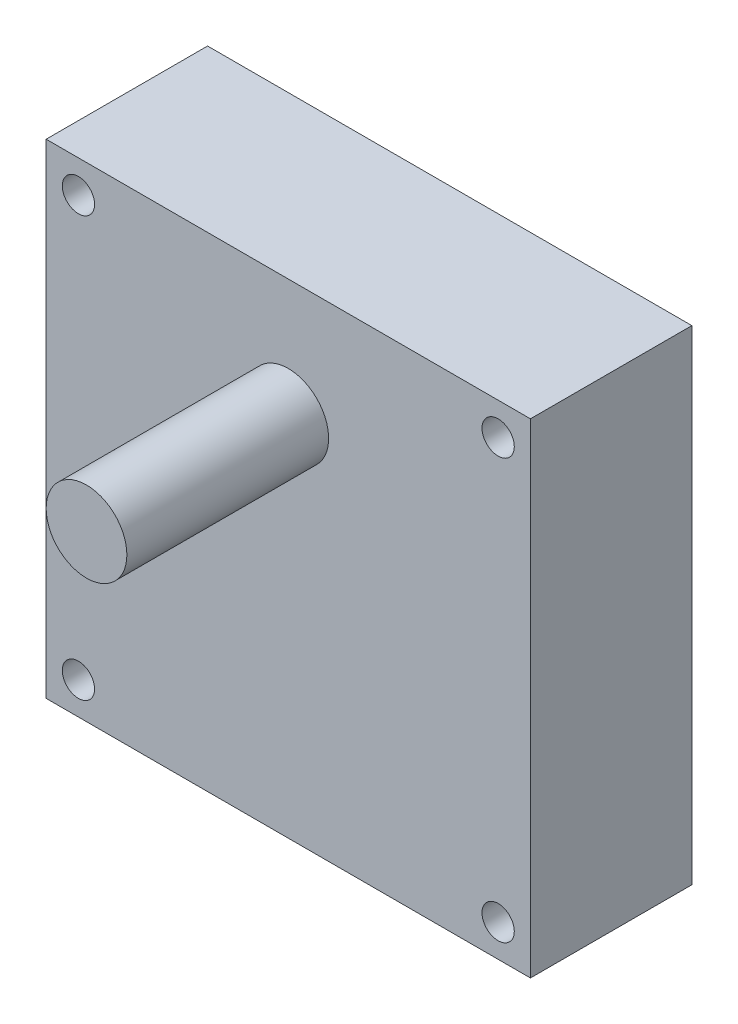
from build123d import *

# Parameters (mm, degrees)
SKETCH1_W           = 60
SKETCH1_H           = 60
BOSS_EXTRUDE1_DEPTH = 20
SKETCH2_R           = 5
BOSS_EXTRUDE2_DEPTH = 25
SKETCH2_3_R         = 2
CUT_EXTRUDE1_DEPTH  = 89.459030065


with BuildPart() as part:
    # Sketch1 → Boss-Extrude1 (new body)
    with BuildSketch(Plane.XY):
        with Locations((-30, -30)):
            Rectangle(SKETCH1_W, SKETCH1_H)
    extrude(amount=BOSS_EXTRUDE1_DEPTH)

    # Sketch2 → Boss-Extrude2 (add)
    with BuildSketch(Plane.XY.offset(20)):
        with Locations((-30, -14.599362292)):
            Circle(SKETCH2_R)
    extrude(amount=BOSS_EXTRUDE2_DEPTH)

    # Sketch2<3> → Cut-Extrude1 (cut, through all)
    with BuildSketch(Plane.XY.offset(20)):
        with Locations((-56, -4)):
            Circle(SKETCH2_3_R)
        with Locations((-4, -4)):
            Circle(SKETCH2_3_R)
        with Locations((-4, -56)):
            Circle(SKETCH2_3_R)
        with Locations((-56, -56)):
            Circle(SKETCH2_3_R)
    extrude(amount=-CUT_EXTRUDE1_DEPTH, mode=Mode.SUBTRACT)


solid = part.part
